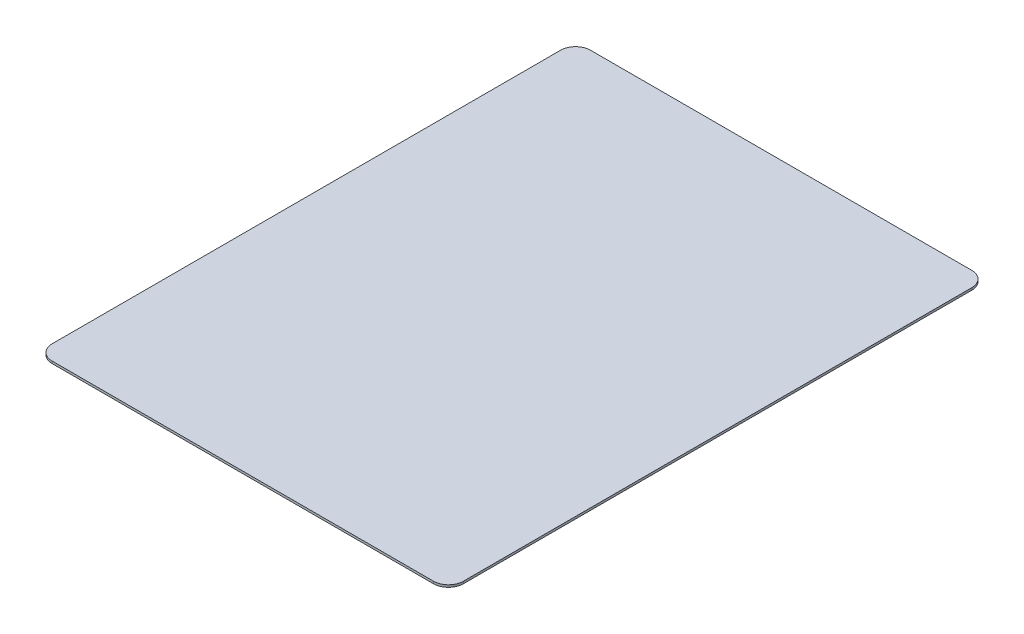
from build123d import *

# Parameters (mm, degrees)
BOSS_EXTRUDE1_DEPTH = 3


with BuildPart() as part:
    # Sketch1 → Boss-Extrude1 (new body)
    with BuildSketch(Plane(origin=(0, 0, 0), x_dir=(1, 0, 0), z_dir=(0, 1, 0))):
        with BuildLine():
            Line((-255, 360), (255, 360))
            ThreePointArc((255, 360), (269.142135624, 354.142135624), (275, 340))
            Line((275, 340), (275, -340))
            ThreePointArc((275, -340), (269.142135624, -354.142135624), (255, -360))
            Line((255, -360), (-255, -360))
            ThreePointArc((-255, -360), (-269.142135624, -354.142135624), (-275, -340))
            Line((-275, -340), (-275, 340))
            ThreePointArc((-275, 340), (-269.142135624, 354.142135624), (-255, 360))
        make_face()
    extrude(amount=BOSS_EXTRUDE1_DEPTH)


solid = part.part
